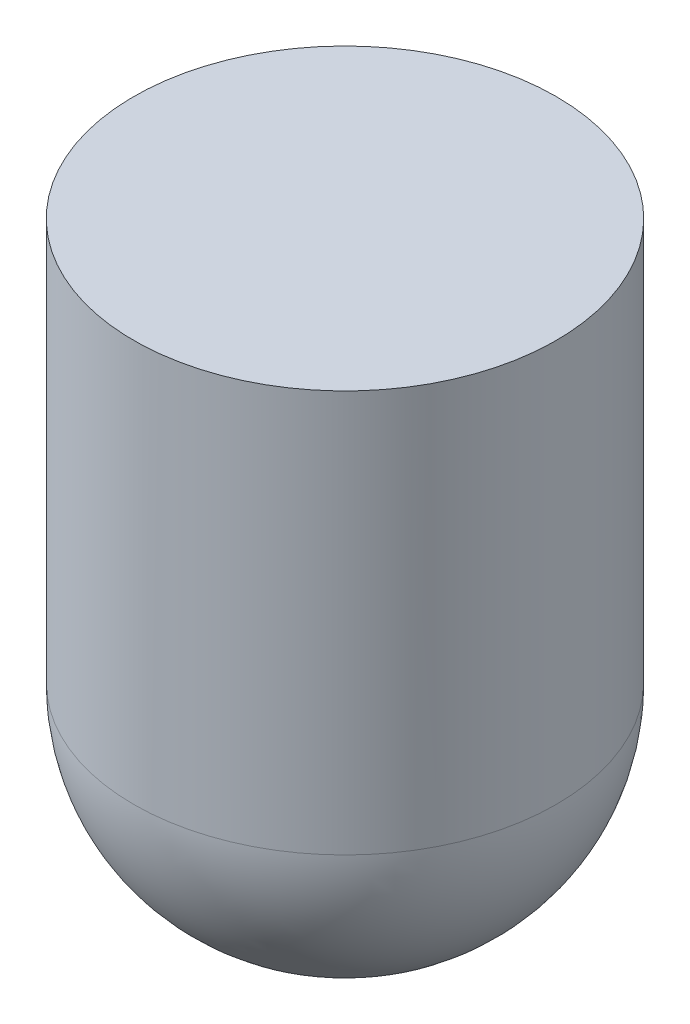
from build123d import *

# Parameters (mm, degrees)
SKETCH2_R           = 130.175
BOSS_EXTRUDE1_DEPTH = 374.65
FILLET1_R           = 127


with BuildPart() as part:
    # Sketch2 → Boss-Extrude1 (new body)
    with BuildSketch(Plane(origin=(0, 0, 0), x_dir=(1, 0, 0), z_dir=(0, 1, 0))):
        with Locations(Location((0, 0, 0), (0, 0, 90))):
            Circle(SKETCH2_R)
    extrude(amount=BOSS_EXTRUDE1_DEPTH)

    # Fillet1
    fillet1_edges = [part.edges().sort_by_distance(p)[0] for p in [
        (0, 0, 130.175),
    ]]
    fillet(fillet1_edges, radius=FILLET1_R)


solid = part.part
